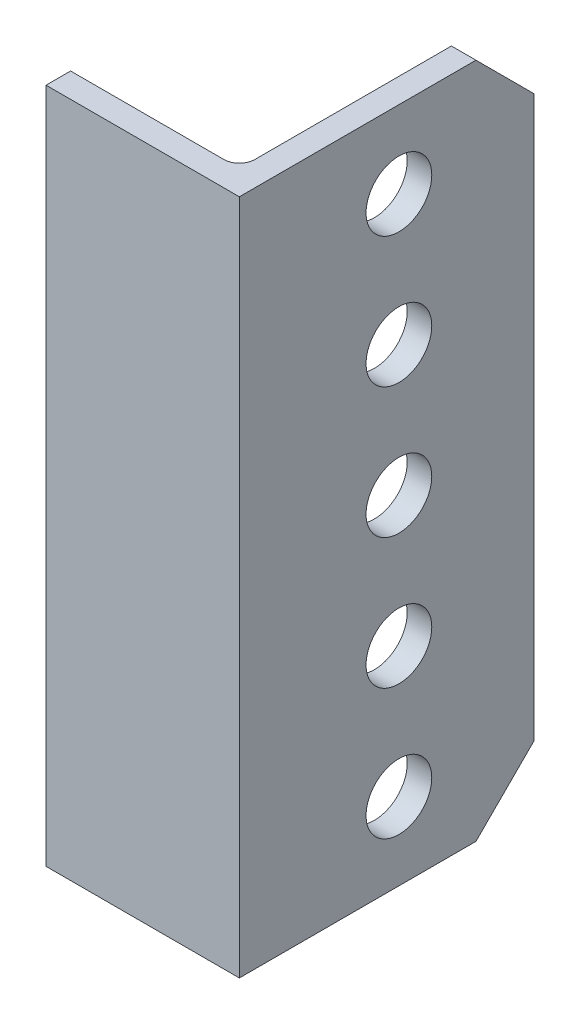
from build123d import *

# Parameters (mm, degrees)
RESSALTO_EXTRUS_O1_DEPTH = 87.5
ESBO_O2_R                = 8.5
CORTE_EXTRUS_O1_DEPTH    = 127.343539605


with BuildPart() as part:
    # Esboço1 → Ressalto-extrusão1 (new, symmetric)
    with BuildSketch(Plane(origin=(0, 0, 0), x_dir=(1, 0, 0), z_dir=(0, 1, 0))):
        with BuildLine():
            Line((-50, 0), (0, 0))
            Line((0, 0), (0, 76.2))
            Line((0, 76.2), (-2.35, 76.2))
            ThreePointArc((-2.35, 76.2), (-5.178427125, 75.028427125), (-6.35, 72.2))
            Line((-6.35, 72.2), (-6.35, 10.35))
            ThreePointArc((-6.35, 10.35), (-7.521572875, 7.521572875), (-10.35, 6.35))
            Line((-10.35, 6.35), (-50, 6.35))
            Line((-50, 6.35), (-50, 0))
        make_face()
    extrude(amount=RESSALTO_EXTRUS_O1_DEPTH, both=True)

    # Esboço2 → Corte-extrusão1 (cut, through all)
    with BuildSketch(Plane(origin=(0, 0, 0), x_dir=(0, 0, -1), z_dir=(1, 0, 0))):
        with Locations((41.27, 67.5)):
            Circle(ESBO_O2_R)
        with Locations((41.27, 33.75)):
            Circle(ESBO_O2_R)
        with Locations((41.27, 0)):
            Circle(ESBO_O2_R)
        with Locations((41.27, -33.75)):
            Circle(ESBO_O2_R)
        with Locations((41.27, -67.5)):
            Circle(ESBO_O2_R)
        Polygon((61.2, 87.5), (76.2, 87.5), (76.2, 72.5), align=None)
        Polygon((76.2, -72.5), (76.2, -87.5), (61.2, -87.5), align=None)
    extrude(amount=-CORTE_EXTRUS_O1_DEPTH, mode=Mode.SUBTRACT)


solid = part.part
